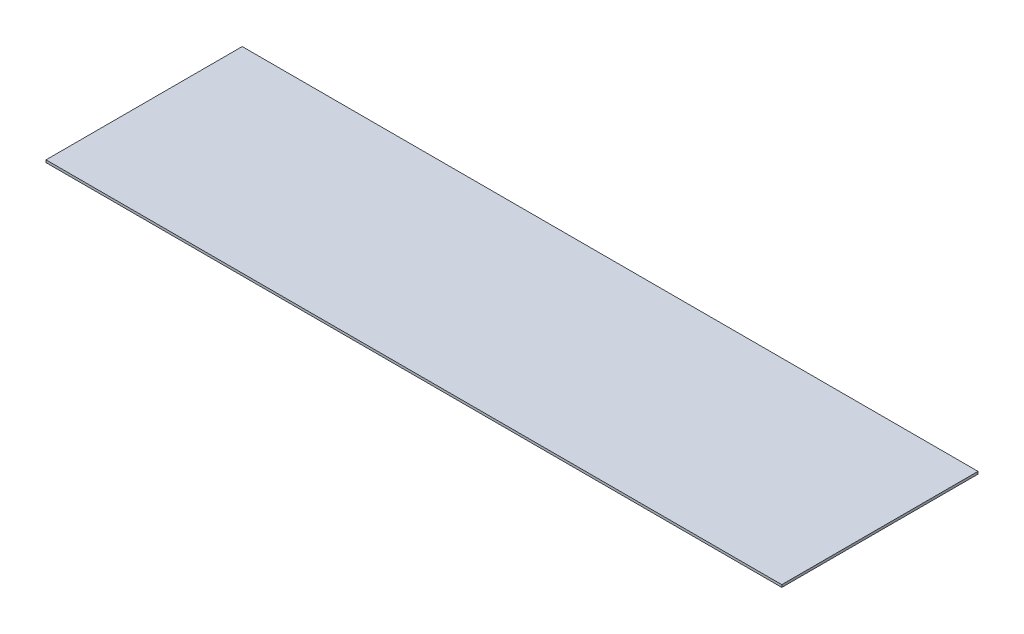
from build123d import *

# Parameters (mm, degrees)
SKETCH1_W           = 1500
SKETCH1_H           = 400
BOSS_EXTRUDE1_DEPTH = 2.5


with BuildPart() as part:
    # Sketch1 → Boss-Extrude1 (new, symmetric)
    with BuildSketch(Plane(origin=(0, 0, 0), x_dir=(1, 0, 0), z_dir=(0, 1, 0))):
        Rectangle(SKETCH1_W, SKETCH1_H)
    extrude(amount=BOSS_EXTRUDE1_DEPTH, both=True)


solid = part.part
